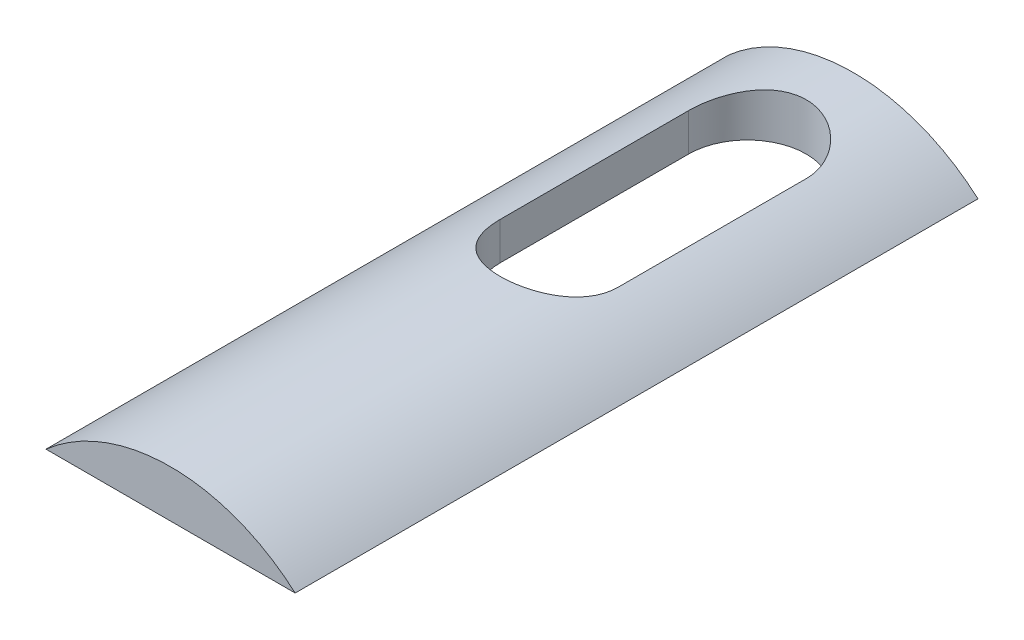
from build123d import *

# Parameters (mm, degrees)
BOSS_EXTRUDE1_DEPTH = 14.5
CUT_EXTRUDE1_DEPTH  = 15.773286703


with BuildPart() as part:
    # Sketch1 → Boss-Extrude1 (new body)
    with BuildSketch(Plane.XY):
        with BuildLine():
            Line((-2.645751311, 0), (2.645751311, 0))
            ThreePointArc((2.645751311, 0), (0, 1), (-2.645751311, 0))
        make_face()
    extrude(amount=BOSS_EXTRUDE1_DEPTH)

    # Sketch2 → Cut-Extrude1 (cut, through all)
    with BuildSketch(Plane.XZ):
        with BuildLine():
            Line((-1.25, 2.25), (-1.25, 6.25))
            ThreePointArc((-1.25, 6.25), (0, 7.5), (1.25, 6.25))
            Line((1.25, 6.25), (1.25, 2.25))
            ThreePointArc((1.25, 2.25), (0, 1), (-1.25, 2.25))
        make_face()
    extrude(amount=-CUT_EXTRUDE1_DEPTH, mode=Mode.SUBTRACT)


solid = part.part
